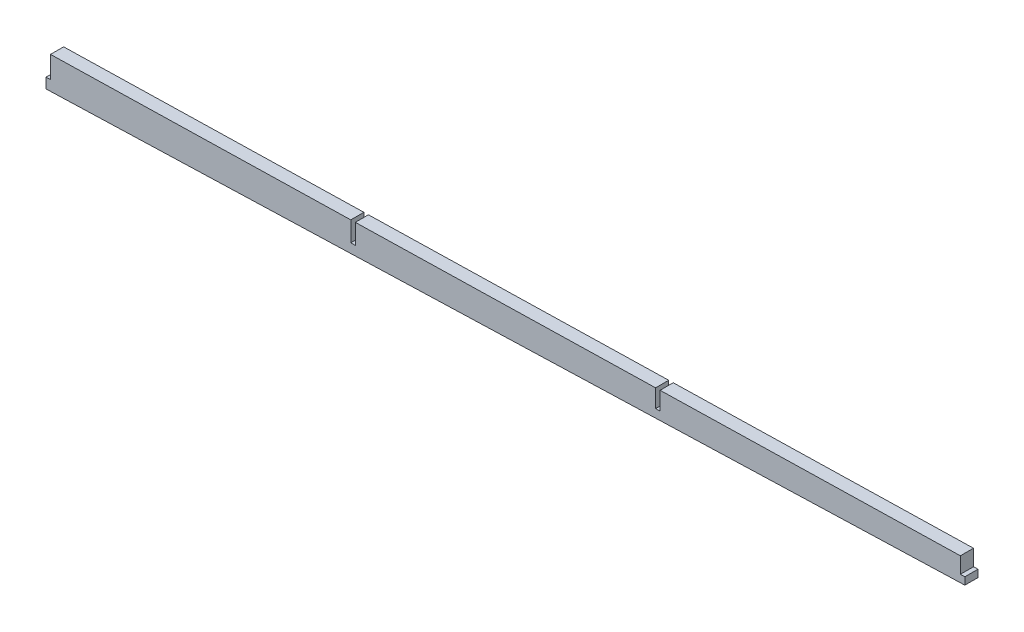
from build123d import *

# Parameters (mm, degrees)
SKETCH_1_W               = 3
SKETCH_1_H               = 240
SKETCH_1_H_2             = 261.76139272
SKETCH_1_H_3             = 230.081843935
CUT_EXTRUDE_2_DEPTH      = 20
CUT_EXTRUDE_7_DEPTH      = 30
CUT_EXTRUDE_8_DEPTH      = 1004.267287526
CUT_EXTRUDE_8_DEPTH_BACK = 1004.267287526
SKETCH_10_W              = 715.558025108
SKETCH_10_H              = 147.805868661


with BuildPart() as part:
    # Эскиз4 → По сечениям1 section 0
    with BuildSketch(Plane(origin=(-1000, 0, 0), x_dir=(0, 0, -1), z_dir=(1, 0, 0))):
        with BuildLine():
            Line((70.5, 15), (70.5, -7))
            Line((70.5, -7), (79.5, -7))
            Line((79.5, -7), (79.5, 15))
            Line((79.5, 15), (70.5, 15))
        make_face()
    # Эскиз5 → По сечениям1 section 1
    with BuildSketch(Plane(origin=(-388, 0, 0), x_dir=(0, 0, -1), z_dir=(1, 0, 0))):
        with BuildLine():
            Line((61.14, 11), (52.14, 11))
            Line((52.14, 11), (52.14, -5))
            Line((52.14, -5), (61.14, -5))
            Line((61.14, -5), (61.14, 11))
        make_face()
    loft()

    # Эскиз1 → Вырез-Вытянуть2 (cut)
    with BuildSketch(Plane(origin=(0, 0, 0), x_dir=(1, 0, 0), z_dir=(0, 1, 0))):
        with Locations((-998.5, 120)):
            Rectangle(SKETCH_1_W, SKETCH_1_H)
        Polygon((-388, 184.92), (-391, 185.19), (-391, 0), (-388, 0), align=None)
        with Locations((-795.5, 130.88069636)):
            Rectangle(SKETCH_1_W, SKETCH_1_H_2)
        with Locations((-592.5, 115.040921968)):
            Rectangle(SKETCH_1_W, SKETCH_1_H_3)
    extrude(amount=-CUT_EXTRUDE_2_DEPTH, mode=Mode.SUBTRACT)

    # Эскиз10 → Вырез-Вытянуть8 (cut, two sides: drawn at the far end of the back side and taken through both)
    with BuildSketch(Plane(origin=(0, 0, 0), x_dir=(1, 0, 0), z_dir=(0, 1, 0)).offset(-CUT_EXTRUDE_8_DEPTH_BACK)):
        with Locations((-683.215880827, 67.559334818)):
            Rectangle(SKETCH_10_W, SKETCH_10_H)
    extrude(amount=CUT_EXTRUDE_8_DEPTH + CUT_EXTRUDE_8_DEPTH_BACK, mode=Mode.SUBTRACT)


with BuildPart() as body_2:
    # Эскиз7 → По сечениям4 section 0
    with BuildSketch(Plane(origin=(-388, 0, 0), x_dir=(0, 0, -1), z_dir=(1, 0, 0))):
        with BuildLine():
            Line((-61.14, -5), (-52.14, -5))
            Line((-52.14, -5), (-52.14, 11))
            Line((-52.14, 11), (-61.14, 11))
            Line((-61.14, 11), (-61.14, -5))
        make_face()
    # Эскиз8 → По сечениям4 section 1
    with BuildSketch(Plane.ZY.offset(1000)):
        with BuildLine():
            Line((70.5, -7), (79.5, -7))
            Line((79.5, -7), (79.5, 15))
            Line((79.5, 15), (70.5, 15))
            Line((70.5, 15), (70.5, -7))
        make_face()
    loft()

    # Эскиз6 → Вырез-Вытянуть7 (cut)
    with BuildSketch(Plane(origin=(0, 0, 0), x_dir=(1, 0, 0), z_dir=(0, 1, 0))):
        Polygon((-391, -52.23), (-391, -61.23), (-388, -61.14), (-388, -52.14), align=None)
        Polygon((-794, -64.32), (-794, -73.32), (-797, -73.41), (-797, -64.41), align=None)
        Polygon((-997, -70.41), (-997, -79.41), (-1000, -79.5), (-1000, -70.5), align=None)
        Polygon((-594, -58.32), (-594, -67.32), (-591, -67.23), (-591, -58.23), align=None)
    extrude(amount=CUT_EXTRUDE_7_DEPTH, mode=Mode.SUBTRACT)


solid = body_2.part
